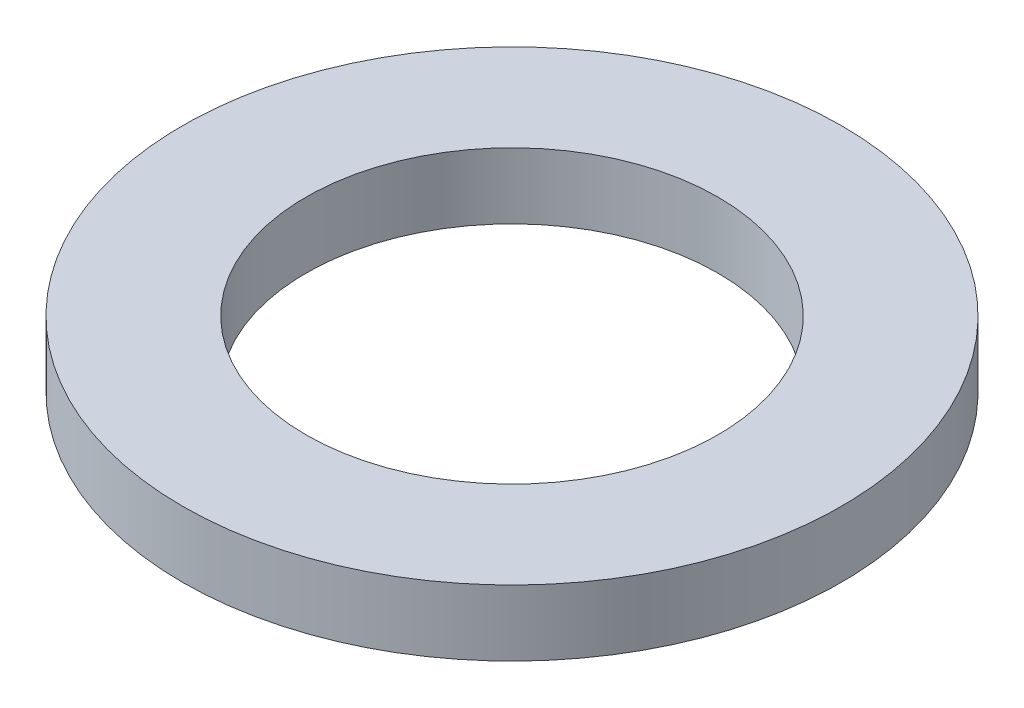
from build123d import *

# Parameters (mm, degrees)
SKETCH_1_R      = 4
SKETCH_1_R_2    = 2.5
EXTRUDE_1_DEPTH = 0.8


with BuildPart() as part:
    # 草图1 → 凸台-拉伸1 (new body)
    with BuildSketch(Plane(origin=(0, 0, 0), x_dir=(1, 0, 0), z_dir=(0, 1, 0))):
        with Locations(Location((0, 0, 0), (0, 0, 270))):
            Circle(SKETCH_1_R)
        with Locations(Location((0, 0, 0), (0, 0, 270))):
            Circle(SKETCH_1_R_2, mode=Mode.SUBTRACT)
    extrude(amount=EXTRUDE_1_DEPTH)


solid = part.part
